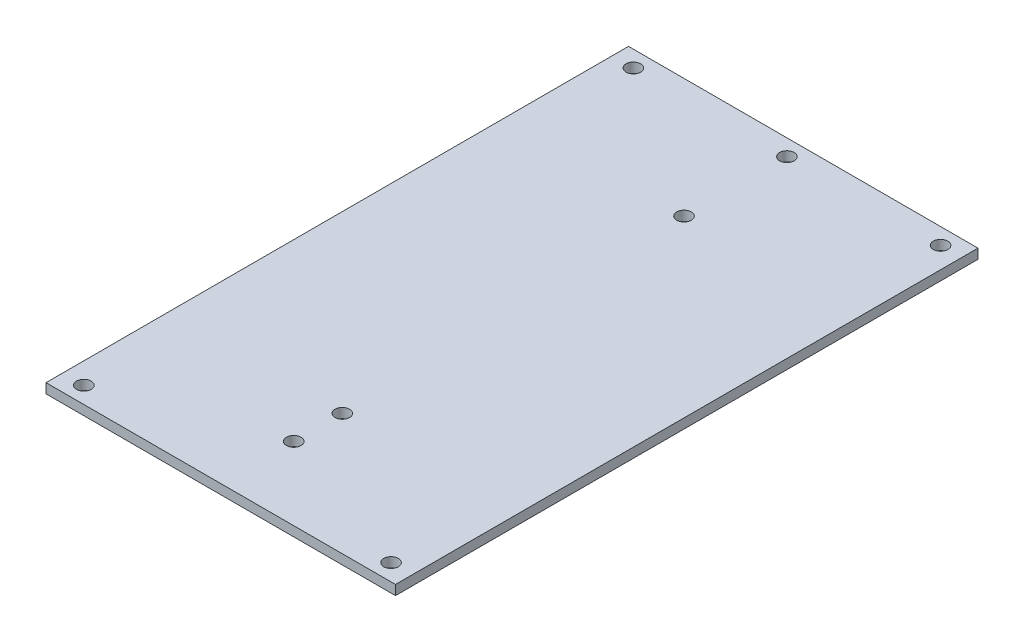
from build123d import *

# Parameters (mm, degrees)
SKETCH1_W           = 228.6
SKETCH1_H           = 381
SKETCH1_R           = 4.7625
BOSS_EXTRUDE1_DEPTH = 6.35


with BuildPart() as part:
    # Sketch1 → Boss-Extrude1 (new body)
    with BuildSketch(Plane(origin=(0, 0, 0), x_dir=(1, 0, 0), z_dir=(0, 1, 0))):
        with Locations((0, 33.528)):
            Rectangle(SKETCH1_W, SKETCH1_H)
        with Locations(Location((0, 146.05, 0), (0, 0, 270))):
            Circle(SKETCH1_R, mode=Mode.SUBTRACT)
        with Locations(Location((-100.457, -146.05, 0), (0, 0, 270))):
            Circle(SKETCH1_R, mode=Mode.SUBTRACT)
        with Locations(Location((100.457, -146.05, 0), (0, 0, 270))):
            Circle(SKETCH1_R, mode=Mode.SUBTRACT)
        with Locations(Location((0, 213.36, 0), (0, 0, 270))):
            Circle(SKETCH1_R, mode=Mode.SUBTRACT)
        with Locations(Location((0, -109.22, 0), (0, 0, 270))):
            Circle(SKETCH1_R, mode=Mode.SUBTRACT)
        with Locations(Location((-100.457, 213.36, 0), (0, 0, 270))):
            Circle(SKETCH1_R, mode=Mode.SUBTRACT)
        with Locations(Location((100.457, 213.36, 0), (0, 0, 270))):
            Circle(SKETCH1_R, mode=Mode.SUBTRACT)
        with Locations(Location((0, -77.47, 0), (0, 0, 270))):
            Circle(SKETCH1_R, mode=Mode.SUBTRACT)
    extrude(amount=BOSS_EXTRUDE1_DEPTH)


solid = part.part
